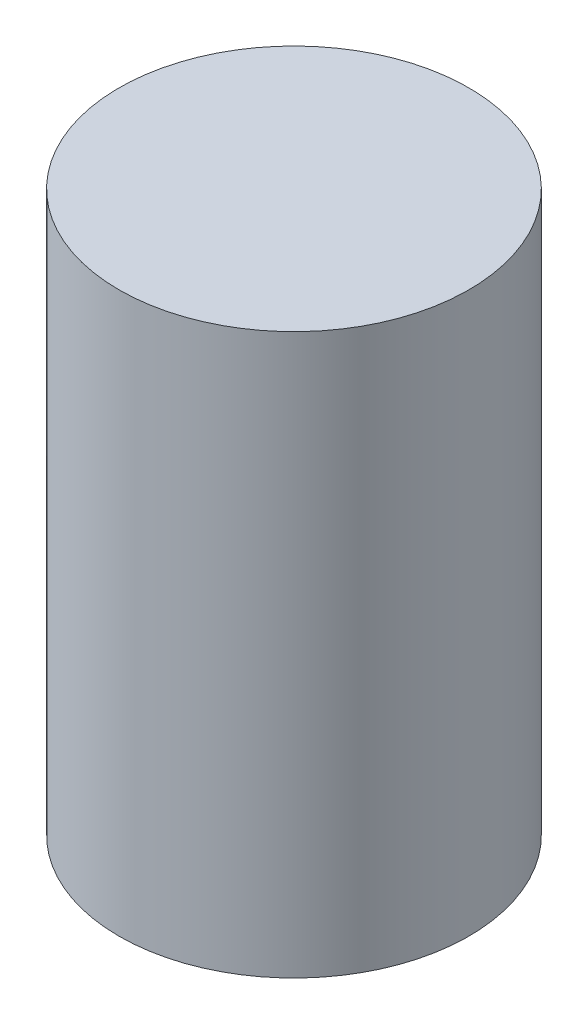
from build123d import *

# Parameters (mm, degrees)
SKETCH1_R           = 63.5
BOSS_EXTRUDE1_DEPTH = 203.2


with BuildPart() as part:
    # Sketch1 → Boss-Extrude1 (new body)
    with BuildSketch(Plane(origin=(0, 0, 0), x_dir=(1, 0, 0), z_dir=(0, 1, 0))):
        with Locations(Location((0, 0, 0), (0, 0, 270))):
            Circle(SKETCH1_R)
    extrude(amount=BOSS_EXTRUDE1_DEPTH)


solid = part.part
